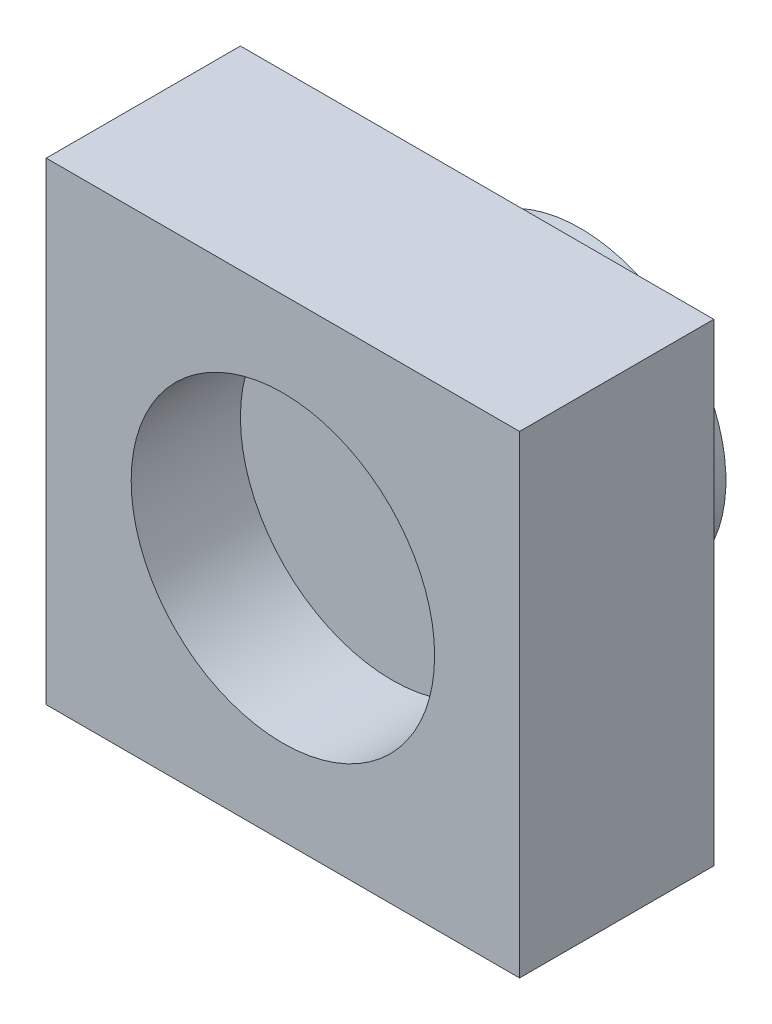
from build123d import *

# Parameters (mm, degrees)
SKETCH_1_W          = 7.8
SKETCH_1_H          = 7.8
EXTRUDE_1_DEPTH     = 3.2
SKETCH_2_R          = 2.5
CUT_EXTRUDE_1_DEPTH = 1.8
SKETCH_3_R          = 2.4
EXTRUDE_2_DEPTH     = 1.7


with BuildPart() as part:
    # Эскиз1 → Бобышка-Вытянуть1 (new body)
    with BuildSketch(Plane.XY):
        Rectangle(SKETCH_1_W, SKETCH_1_H)
    extrude(amount=EXTRUDE_1_DEPTH)

    # Эскиз2 → Вырез-Вытянуть1 (cut)
    with BuildSketch(Plane.XY.offset(3.2)):
        Circle(SKETCH_2_R)
    extrude(amount=-CUT_EXTRUDE_1_DEPTH, mode=Mode.SUBTRACT)

    # Эскиз3 → Бобышка-Вытянуть2 (add)
    with BuildSketch(Plane(origin=(0, 0, 0), x_dir=(-1, 0, 0), z_dir=(0, 0, -1))):
        Circle(SKETCH_3_R)
    extrude(amount=EXTRUDE_2_DEPTH)


solid = part.part
